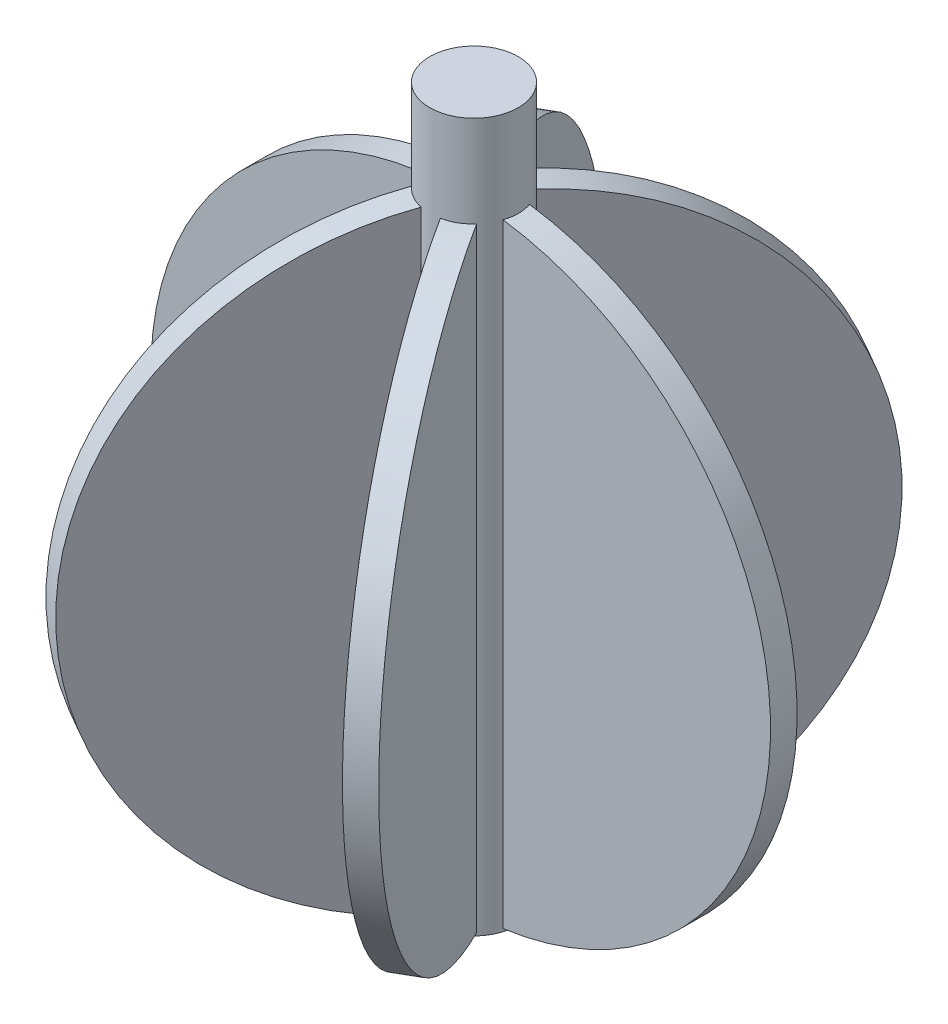
from build123d import *

# Parameters (mm, degrees)
SKETCH2_R           = 5
BOSS_EXTRUDE1_DEPTH = 80
BOSS_EXTRUDE2_DEPTH = 1.5
CIRPATTERN1_COUNT   = 6
CUT_EXTRUDE1_DEPTH  = 10


with BuildPart() as part:
    # Sketch2 → Boss-Extrude1 (new body)
    with BuildSketch(Plane(origin=(0, 0, 0), x_dir=(1, 0, 0), z_dir=(0, 1, 0))):
        Circle(SKETCH2_R)
    extrude(amount=BOSS_EXTRUDE1_DEPTH)

    # Sketch3 → Boss-Extrude2 (add, symmetric)
    with BuildSketch(Plane.XY):
        with BuildLine():
            Line((0, 70), (0, 0))
            ThreePointArc((0, 0), (35, 35), (0, 70))
        make_face()
    boss_extrude2 = extrude(amount=BOSS_EXTRUDE2_DEPTH, both=True)

    # CirPattern1: Boss-Extrude2 ×6 about axis
    cirpattern1_axis = Axis((0, 80, 0), (0, -1, 0))
    for i in range(1, CIRPATTERN1_COUNT):
        add(boss_extrude2.rotate(cirpattern1_axis, i * 360 / CIRPATTERN1_COUNT))

    # Sketch4 → Cut-Extrude1 (cut)
    with BuildSketch(Plane.XZ):
        with BuildLine():
            Line((-0.5, 1.414213562), (-0.5, -1.414213562))
            ThreePointArc((-0.5, -1.414213562), (1.5, 0), (-0.5, 1.414213562))
        make_face()
    extrude(amount=-CUT_EXTRUDE1_DEPTH, mode=Mode.SUBTRACT)


solid = part.part
